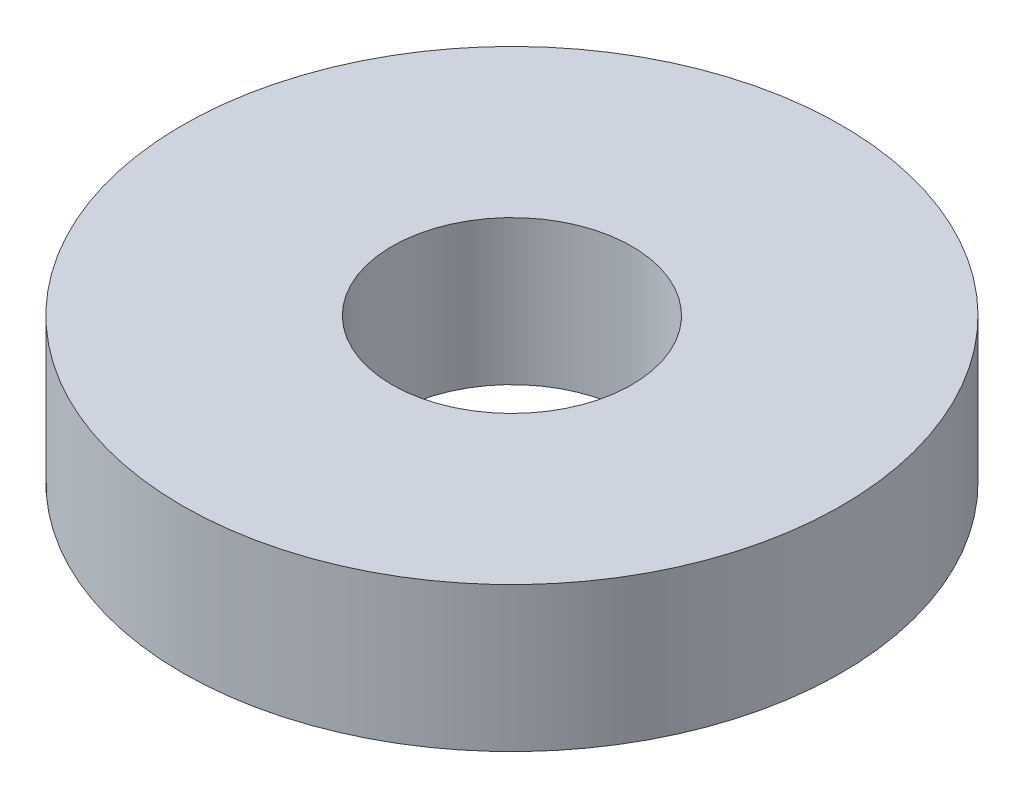
from build123d import *

# Parameters (mm, degrees)
SKETCH1_R           = 22.784902686
SKETCH1_R_2         = 8.292130067
BOSS_EXTRUDE1_DEPTH = 10


with BuildPart() as part:
    # Sketch1 → Boss-Extrude1 (new body)
    with BuildSketch(Plane(origin=(0, 0, 0), x_dir=(1, 0, 0), z_dir=(0, 1, 0))):
        with Locations(Location((0, 0, 0), (0, 0, 270))):
            Circle(SKETCH1_R)
        with Locations(Location((0, 0, 0), (0, 0, 270))):
            Circle(SKETCH1_R_2, mode=Mode.SUBTRACT)
    extrude(amount=BOSS_EXTRUDE1_DEPTH)


solid = part.part
